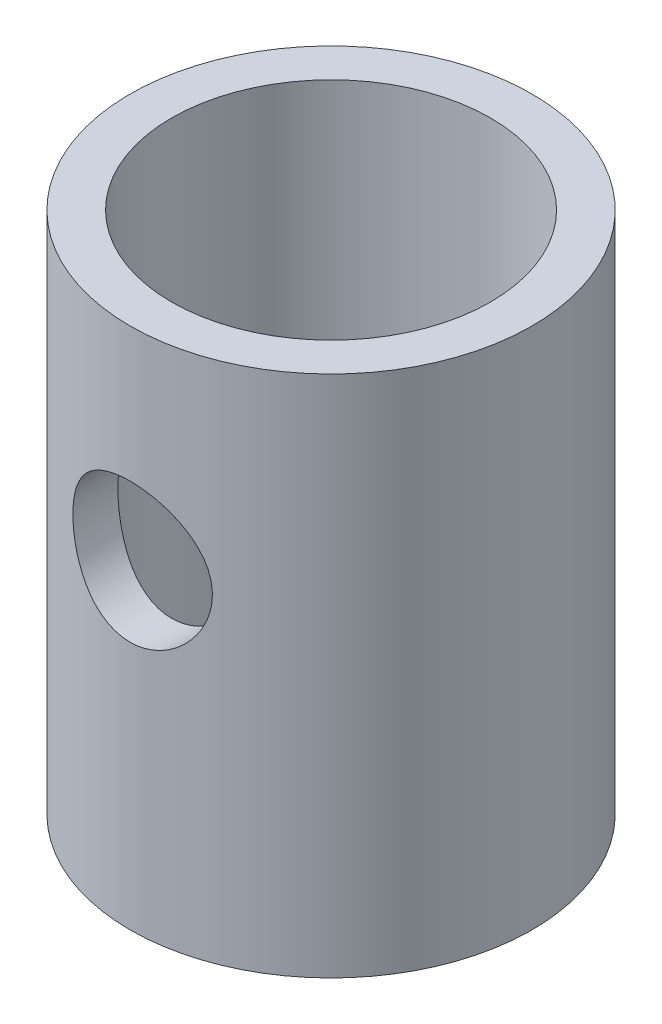
from build123d import *

# Parameters (mm, degrees)
SKETCH1_R           = 8.001
SKETCH1_R_2         = 6.35
BOSS_EXTRUDE1_DEPTH = 20.828
SKETCH2_R           = 2.77876
CUT_EXTRUDE1_DEPTH  = 6.35


with BuildPart() as part:
    # Sketch1 → Boss-Extrude1 (new body)
    with BuildSketch(Plane(origin=(0, 0, 0), x_dir=(1, 0, 0), z_dir=(0, 1, 0))):
        with Locations(Location((0, 0, 0), (0, 0, 270))):
            Circle(SKETCH1_R)
        with Locations(Location((0, 0, 0), (0, 0, 270))):
            Circle(SKETCH1_R_2, mode=Mode.SUBTRACT)
    extrude(amount=BOSS_EXTRUDE1_DEPTH)

    # Sketch2 → Cut-Extrude1 (cut)
    with BuildSketch(Plane.XY.offset(8.001)):
        with Locations((0, 12.7)):
            Circle(SKETCH2_R)
    extrude(amount=-CUT_EXTRUDE1_DEPTH, mode=Mode.SUBTRACT)


solid = part.part
